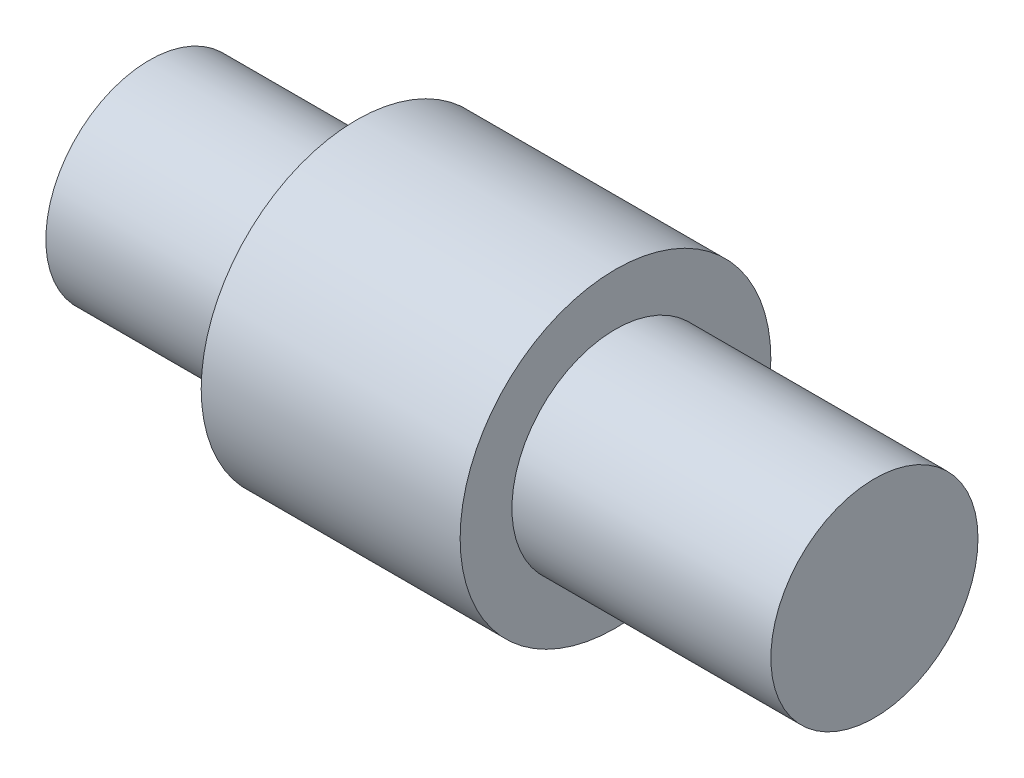
from build123d import *

# Parameters (mm, degrees)
SKETCH1_R                = 3
BOSS_EXTRUDE1_DEPTH      = 5
BOSS_EXTRUDE2_DEPTH      = 5
BOSS_EXTRUDE2_DEPTH_BACK = 9
SKETCH2_R                = 2


with BuildPart() as part:
    # Sketch1 → Boss-Extrude1 (new body)
    with BuildSketch(Plane(origin=(0, 0, 0), x_dir=(0, 0, -1), z_dir=(1, 0, 0))):
        Circle(SKETCH1_R)
    extrude(amount=BOSS_EXTRUDE1_DEPTH)

    # Sketch2 → Boss-Extrude2 (add, two sides: drawn at the far end of the back side and taken through both)
    with BuildSketch(Plane(origin=(5, 0, 0), x_dir=(0, 0, -1), z_dir=(1, 0, 0)).offset(-BOSS_EXTRUDE2_DEPTH_BACK)):
        Circle(SKETCH2_R)
    extrude(amount=BOSS_EXTRUDE2_DEPTH + BOSS_EXTRUDE2_DEPTH_BACK)


solid = part.part
